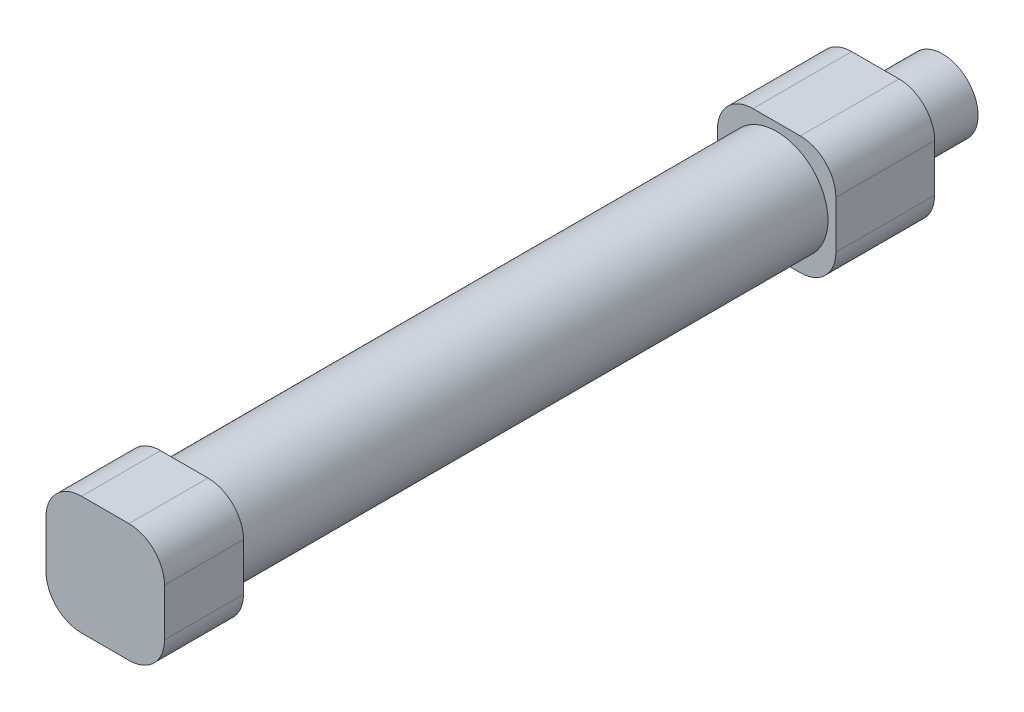
from build123d import *

# Parameters (mm, degrees)
SKETCH_1_W          = 15
SKETCH_1_H          = 15
EXTRUDE_1_DEPTH     = 10
FILLET_1_R          = 4.5
SKETCH_2_R          = 2.5
CUT_EXTRUDE_1_DEPTH = 4.8
SKETCH_4_R          = 6.5
EXTRUDE_2_DEPTH     = 75
SKETCH_6_W          = 15
SKETCH_6_H          = 15
EXTRUDE_3_DEPTH     = 12.5
FILLET_2_R          = 4.5
SKETCH_7_R          = 4.5
EXTRUDE_4_DEPTH     = 8.5
SKETCH_13_R         = 2.5
CUT_EXTRUDE_2_DEPTH = 4.8
SKETCH_16_R         = 2.5
CUT_EXTRUDE_6_DEPTH = 60


with BuildPart() as part:
    # 草图1 → 凸台-拉伸1 (new body)
    with BuildSketch(Plane.XY):
        Rectangle(SKETCH_1_W, SKETCH_1_H)
    extrude(amount=EXTRUDE_1_DEPTH)

    # 圆角1
    fillet_1_edges = [part.edges().sort_by_distance(p)[0] for p in [
        (7.5, -7.5, 5),
        (-7.5, -7.5, 5),
        (-7.5, 7.5, 5),
        (7.5, 7.5, 5),
    ]]
    fillet(fillet_1_edges, radius=FILLET_1_R)

    # 草图2 → 切除-拉伸1 (cut)
    with BuildSketch(Plane.ZY.offset(7.5)):
        with Locations((5, 0)):
            Circle(SKETCH_2_R)
    extrude(amount=-CUT_EXTRUDE_1_DEPTH, mode=Mode.SUBTRACT)

    # 草图4 → 凸台-拉伸2 (add)
    with BuildSketch(Plane(origin=(0, 0, 0), x_dir=(-1, 0, 0), z_dir=(0, 0, -1))):
        Circle(SKETCH_4_R)
    extrude(amount=EXTRUDE_2_DEPTH)

    # 草图6 → 凸台-拉伸3 (add)
    with BuildSketch(Plane(origin=(0, 0, -75), x_dir=(-1, 0, 0), z_dir=(0, 0, -1))):
        Rectangle(SKETCH_6_W, SKETCH_6_H)
    extrude(amount=EXTRUDE_3_DEPTH)

    # 圆角2
    fillet_2_edges = [part.edges().sort_by_distance(p)[0] for p in [
        (-7.5, -7.5, -81.25),
        (-7.5, 7.5, -81.25),
        (7.5, 7.5, -81.25),
        (7.5, -7.5, -81.25),
    ]]
    fillet(fillet_2_edges, radius=FILLET_2_R)

    # 草图7 → 凸台-拉伸4 (add)
    with BuildSketch(Plane(origin=(0, 0, -87.5), x_dir=(-1, 0, 0), z_dir=(0, 0, -1))):
        Circle(SKETCH_7_R)
    extrude(amount=EXTRUDE_4_DEPTH)

    # 草图13 → 切除-拉伸2 (cut)
    with BuildSketch(Plane.ZY.offset(7.5)):
        with Locations((-79.5, 0)):
            Circle(SKETCH_13_R)
    extrude(amount=-CUT_EXTRUDE_2_DEPTH, mode=Mode.SUBTRACT)

    # 草图16 → 切除-拉伸6 (cut)
    with BuildSketch(Plane(origin=(0, 0, -96), x_dir=(-1, 0, 0), z_dir=(0, 0, -1))):
        Circle(SKETCH_16_R)
    extrude(amount=-CUT_EXTRUDE_6_DEPTH, mode=Mode.SUBTRACT)


solid = part.part
